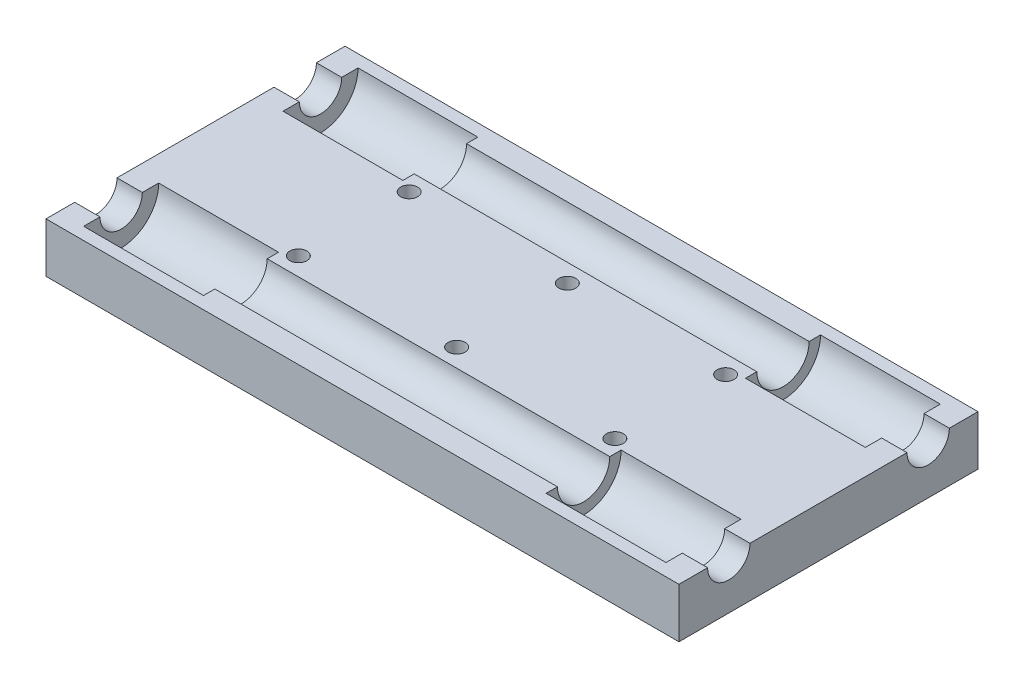
from build123d import *

# Parameters (mm, degrees)
SKETCH1_W                      = 127
SKETCH1_H                      = 60
BOSS_EXTRUDE1_DEPTH            = 10
CUT_EXTRUDE1_START             = -5.08
SKETCH3_R                      = 7.525
CUT_EXTRUDE1_DEPTH             = 24.05
CUT_EXTRUDE2_REACH             = 127.954
SKETCH4_R                      = 4.25
CUT_EXTRUDE2_DIRECTION_2_REACH = 127.954
CUT_EXTRUDE3_START             = -68.74
SKETCH5_R                      = 5.25
SKETCH5_R_2                    = 4.25
CUT_EXTRUDE3_DEPTH             = 68.74
CBORE_FOR_M3_SHCS1_D           = 3.4
CBORE_FOR_M3_SHCS1_CBORE_D     = 6.5
CBORE_FOR_M3_SHCS1_CBORE_DEPTH = 3.254


with BuildPart() as part:
    # Sketch1 → Boss-Extrude1 (new body)
    with BuildSketch(Plane(origin=(0, 0, 0), x_dir=(1, 0, 0), z_dir=(0, 1, 0))):
        Rectangle(SKETCH1_W, SKETCH1_H)
    extrude(amount=BOSS_EXTRUDE1_DEPTH)

    # Sketch3 → Cut-Extrude1 (cut)
    with BuildSketch(Plane.ZY.offset(63.5).offset(CUT_EXTRUDE1_START)):
        with Locations((-20, 10)):
            Circle(SKETCH3_R)
        with Locations((20, 10)):
            Circle(SKETCH3_R)
    cut_extrude1 = extrude(amount=-CUT_EXTRUDE1_DEPTH, mode=Mode.SUBTRACT)

    # Mirror1: Cut-Extrude1 across plane
    add(cut_extrude1.mirror(Plane(origin=(0, 0, 0), x_dir=(0, 0, 1), z_dir=(1, 0, 0))), mode=Mode.SUBTRACT)

    # Sketch4 → Cut-Extrude2 (cut, up to next)
    with BuildSketch(Plane(origin=(-58.42, 0, 0), x_dir=(0, 0, -1), z_dir=(1, 0, 0)), mode=Mode.PRIVATE) as cut_extrude2_sk1:
        with Locations((20, 10)):
            Circle(SKETCH4_R)
    cut_extrude2_tool1 = extrude(cut_extrude2_sk1.sketch, amount=-CUT_EXTRUDE2_REACH, mode=Mode.PRIVATE) & part.part
    cut_extrude2 = cut_extrude2_tool1.solids().sort_by_distance((-58.42, 10, -20))[0]
    add(cut_extrude2, mode=Mode.SUBTRACT)

    # Cut-Extrude2 direction 2: up to this face of the body (flat: up to its plane)
    cut_extrude2_direction_2_end = Plane(part.part.faces().sort_by_distance((63.5, 5, 0))[0])
    # Sketch4 → Cut-Extrude2 direction 2 (cut, up to the picked face)
    with BuildSketch(Plane(origin=(-58.42, 0, 0), x_dir=(0, 0, -1), z_dir=(1, 0, 0)), mode=Mode.PRIVATE) as cut_extrude2_direction_2_sk1:
        with Locations((20, 10)):
            Circle(SKETCH4_R)
    cut_extrude2_direction_2_tool1 = split(extrude(cut_extrude2_direction_2_sk1.sketch, amount=CUT_EXTRUDE2_DIRECTION_2_REACH, mode=Mode.PRIVATE), bisect_by=cut_extrude2_direction_2_end, keep=Keep.BOTH, mode=Mode.PRIVATE)
    cut_extrude2_direction_2 = cut_extrude2_direction_2_tool1.solids().sort_by(Axis((-58.42, 10, -20), (1, 0, 0)))[0]
    add(cut_extrude2_direction_2, mode=Mode.SUBTRACT)

    # Mirror2: Cut-Extrude2, Cut-Extrude2 direction 2 across plane
    add(cut_extrude2.mirror(Plane.XY), mode=Mode.SUBTRACT)
    add(cut_extrude2_direction_2.mirror(Plane.XY), mode=Mode.SUBTRACT)

    # Sketch5 → Cut-Extrude3 (cut)
    with BuildSketch(Plane(origin=(34.37, 0, 0), x_dir=(0, 0, -1), z_dir=(1, 0, 0)).offset(CUT_EXTRUDE3_START)):
        with Locations((-20, 10)):
            Circle(SKETCH5_R)
        with Locations((-20, 10)):
            Circle(SKETCH5_R_2, mode=Mode.SUBTRACT)
    cut_extrude3 = extrude(amount=CUT_EXTRUDE3_DEPTH, mode=Mode.SUBTRACT)

    # Mirror3: Cut-Extrude3 across plane
    add(cut_extrude3.mirror(Plane.XY), mode=Mode.SUBTRACT)

    # CBORE for M3 SHCS1 (through all)
    with Locations(Plane(origin=(0, 0, 0), x_dir=(-1, 0, 0), z_dir=(0, -1, 0))):
        with Locations((-31.75, -11.1125), (0, -11.1125), (31.75, -11.1125), (-31.75, 11.1125), (0, 11.1125), (31.75, 11.1125)):
            CounterBoreHole(CBORE_FOR_M3_SHCS1_D / 2, CBORE_FOR_M3_SHCS1_CBORE_D / 2, CBORE_FOR_M3_SHCS1_CBORE_DEPTH)


solid = part.part
